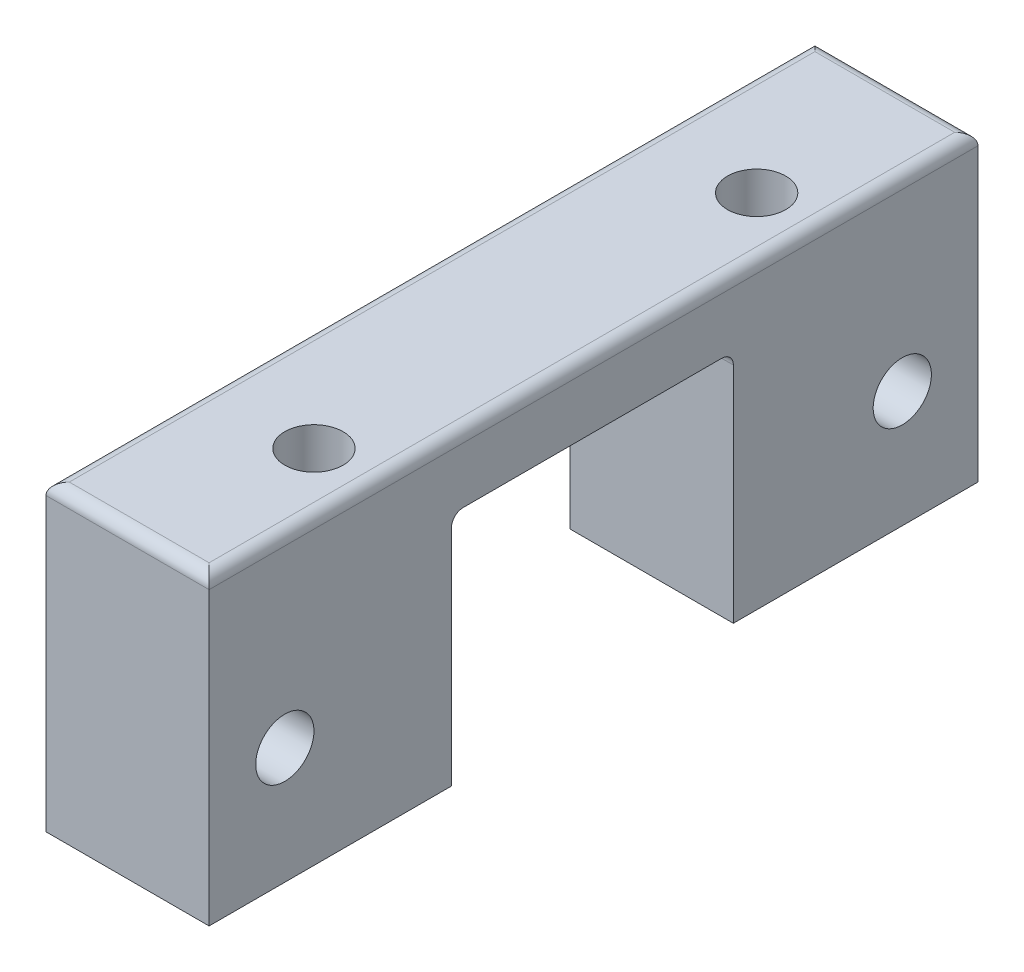
from build123d import *

# Parameters (mm, degrees)
SKETCH1_W           = 7
SKETCH1_H           = 33
BOSS_EXTRUDE1_DEPTH = 13
FILLET4_R           = 0.5
SKETCH3_R           = 1.25
CUT_EXTRUDE1_DEPTH  = 22.295539439
SKETCH5_R           = 1.25
SKETCH5_W           = 12.1
SKETCH5_H           = 10.1
CUT_EXTRUDE2_DEPTH  = 23.141589825
FILLET5_R           = 0.5


with BuildPart() as part:
    # Sketch1 → Boss-Extrude1 (new body)
    with BuildSketch(Plane(origin=(0, 0, 0), x_dir=(1, 0, 0), z_dir=(0, 1, 0))):
        Rectangle(SKETCH1_W, SKETCH1_H)
    extrude(amount=BOSS_EXTRUDE1_DEPTH)

    # Fillet4
    fillet4_edges = [part.edges().sort_by_distance(p)[0] for p in [
        (0, 13, 16.5),
        (-3.5, 13, 0),
        (0, 13, -16.5),
        (3.5, 13, 0),
    ]]
    fillet(fillet4_edges, radius=FILLET4_R)

    # Sketch3 → Cut-Extrude1 (cut, through all)
    with BuildSketch(Plane(origin=(0, 13, 0), x_dir=(1, 0, 0), z_dir=(0, 1, 0))):
        with Locations(Location((1, 9.5, 0), (0, 0, 270))):
            Circle(SKETCH3_R)
        with Locations(Location((1, -9.5, 0), (0, 0, 270))):
            Circle(SKETCH3_R)
    extrude(amount=-CUT_EXTRUDE1_DEPTH, mode=Mode.SUBTRACT)

    # Sketch5 → Cut-Extrude2 (cut, through all)
    with BuildSketch(Plane.ZY.offset(3.5)):
        with Locations((-13.25, 5)):
            Circle(SKETCH5_R)
        with Locations(Location((13.25, 5, 0), (0, 0, 180))):
            Circle(SKETCH5_R)
        with Locations((0.05, 5.05)):
            Rectangle(SKETCH5_W, SKETCH5_H)
    extrude(amount=-CUT_EXTRUDE2_DEPTH, mode=Mode.SUBTRACT)

    # Fillet5
    fillet5_edges = [part.edges().sort_by_distance(p)[0] for p in [
        (0, 10.1, -6),
        (0, 10.1, 6.1),
    ]]
    fillet(fillet5_edges, radius=FILLET5_R)


solid = part.part
